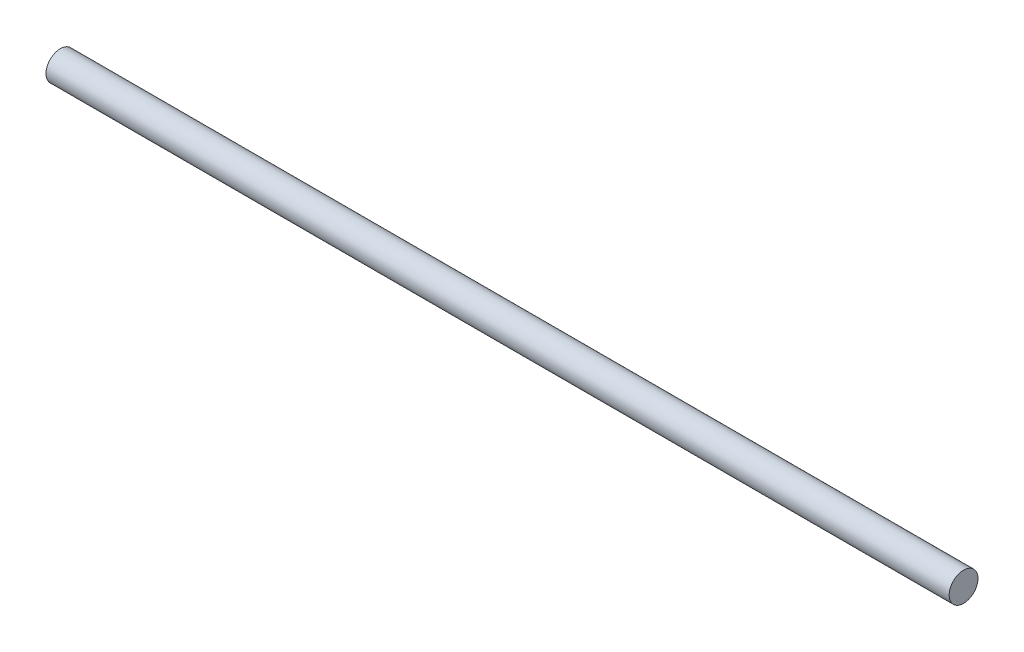
from build123d import *

# Parameters (mm, degrees)
SKETCH1_R           = 4.7625
BOSS_EXTRUDE1_DEPTH = 298.45


with BuildPart() as part:
    # Sketch1 → Boss-Extrude1 (new body)
    with BuildSketch(Plane(origin=(0, 0, 0), x_dir=(0, 0, -1), z_dir=(1, 0, 0))):
        Circle(SKETCH1_R)
    extrude(amount=BOSS_EXTRUDE1_DEPTH)


solid = part.part
